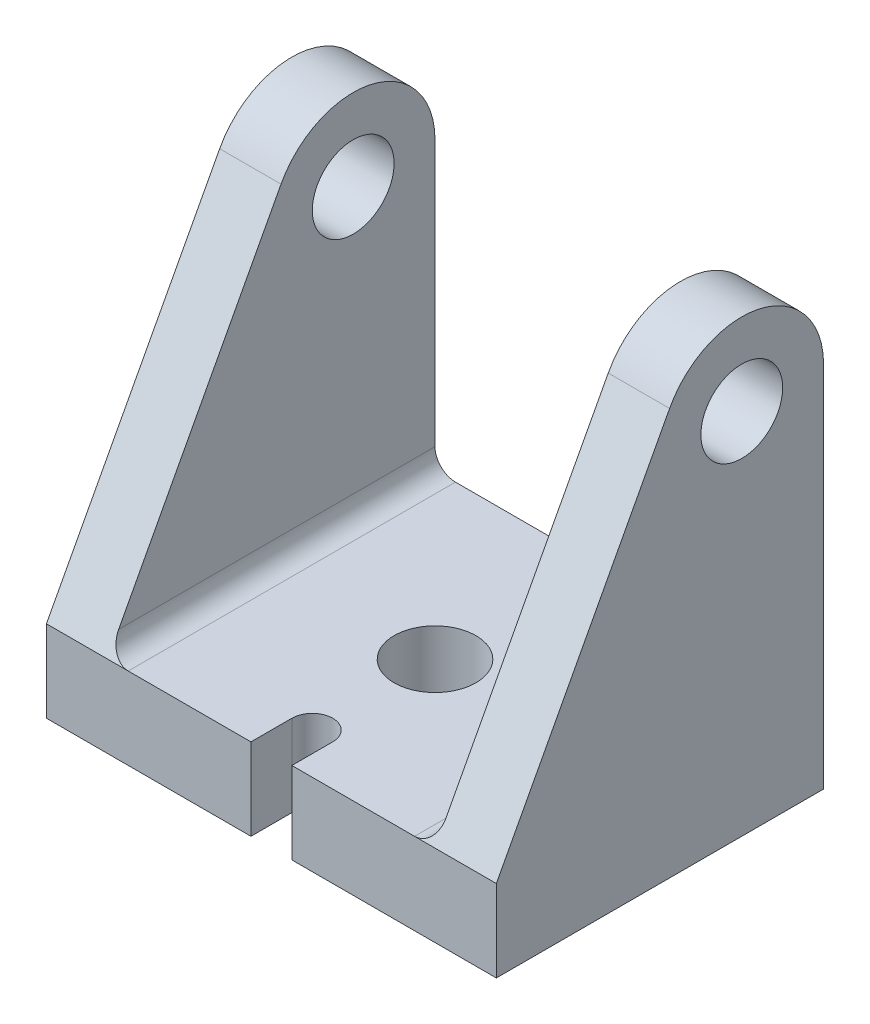
from build123d import *

# Parameters (mm, degrees)
SKETCH1_W           = 69.85
SKETCH1_H           = 50.8
BOSS_EXTRUDE1_DEPTH = 12.7
BOSS_EXTRUDE2_START = 34.925
SKETCH2_R           = 6.35
BOSS_EXTRUDE2_DEPTH = 9.525
BOSS_EXTRUDE3_START = -25.4
SKETCH2_2_R         = 6.35
BOSS_EXTRUDE3_DEPTH = 9.525
SKETCH3_R           = 6.35
CUT_EXTRUDE1_DEPTH  = 72.631264997
FILLET2_R           = 3.175


with BuildPart() as part:
    # Sketch1 → Boss-Extrude1 (new body)
    with BuildSketch(Plane(origin=(0, 0, 0), x_dir=(1, 0, 0), z_dir=(0, 1, 0))):
        Rectangle(SKETCH1_W, SKETCH1_H)
    extrude(amount=BOSS_EXTRUDE1_DEPTH)

    # Sketch2 → Boss-Extrude2 (add)
    with BuildSketch(Plane(origin=(0, 0, 0), x_dir=(0, 0, -1), z_dir=(1, 0, 0)).offset(BOSS_EXTRUDE2_START)):
        with BuildLine():
            Line((-25.4, 12.7), (1.494117647, 63.126470588))
            ThreePointArc((1.494117647, 63.126470588), (15.780202438, 69.470809752), (25.4, 57.15))
            Line((25.4, 57.15), (25.4, 12.7))
            Line((25.4, 12.7), (-25.4, 12.7))
        make_face()
        with Locations((12.7, 57.15)):
            Circle(SKETCH2_R, mode=Mode.SUBTRACT)
    extrude(amount=-BOSS_EXTRUDE2_DEPTH)

    # Sketch2<2> → Boss-Extrude3 (add)
    with BuildSketch(Plane(origin=(0, 0, 0), x_dir=(0, 0, -1), z_dir=(1, 0, 0)).offset(BOSS_EXTRUDE3_START)):
        with BuildLine():
            Line((-25.4, 12.7), (1.494117647, 63.126470588))
            ThreePointArc((1.494117647, 63.126470588), (15.780202438, 69.470809752), (25.4, 57.15))
            Line((25.4, 57.15), (25.4, 12.7))
            Line((25.4, 12.7), (-25.4, 12.7))
        make_face()
        with Locations((12.7, 57.15)):
            Circle(SKETCH2_2_R, mode=Mode.SUBTRACT)
    extrude(amount=-BOSS_EXTRUDE3_DEPTH)

    # Sketch3 → Cut-Extrude1 (cut, through all)
    with BuildSketch(Plane(origin=(0, 12.7, 0), x_dir=(1, 0, 0), z_dir=(0, 1, 0))):
        with Locations(Location((0, 0, 0), (0, 0, 270))):
            Circle(SKETCH3_R)
        with BuildLine():
            Line((3.175, -19.05), (3.175, -25.4))
            Line((3.175, -25.4), (-3.175, -25.4))
            Line((-3.175, -25.4), (-3.175, -19.05))
            ThreePointArc((-3.175, -19.05), (0, -15.875), (3.175, -19.05))
        make_face()
    extrude(amount=-CUT_EXTRUDE1_DEPTH, mode=Mode.SUBTRACT)

    # Fillet2
    fillet2_edges = [part.edges().sort_by_distance(p)[0] for p in [
        (25.4, 12.7, 0),
        (-25.4, 12.7, 0),
    ]]
    fillet(fillet2_edges, radius=FILLET2_R)


solid = part.part
